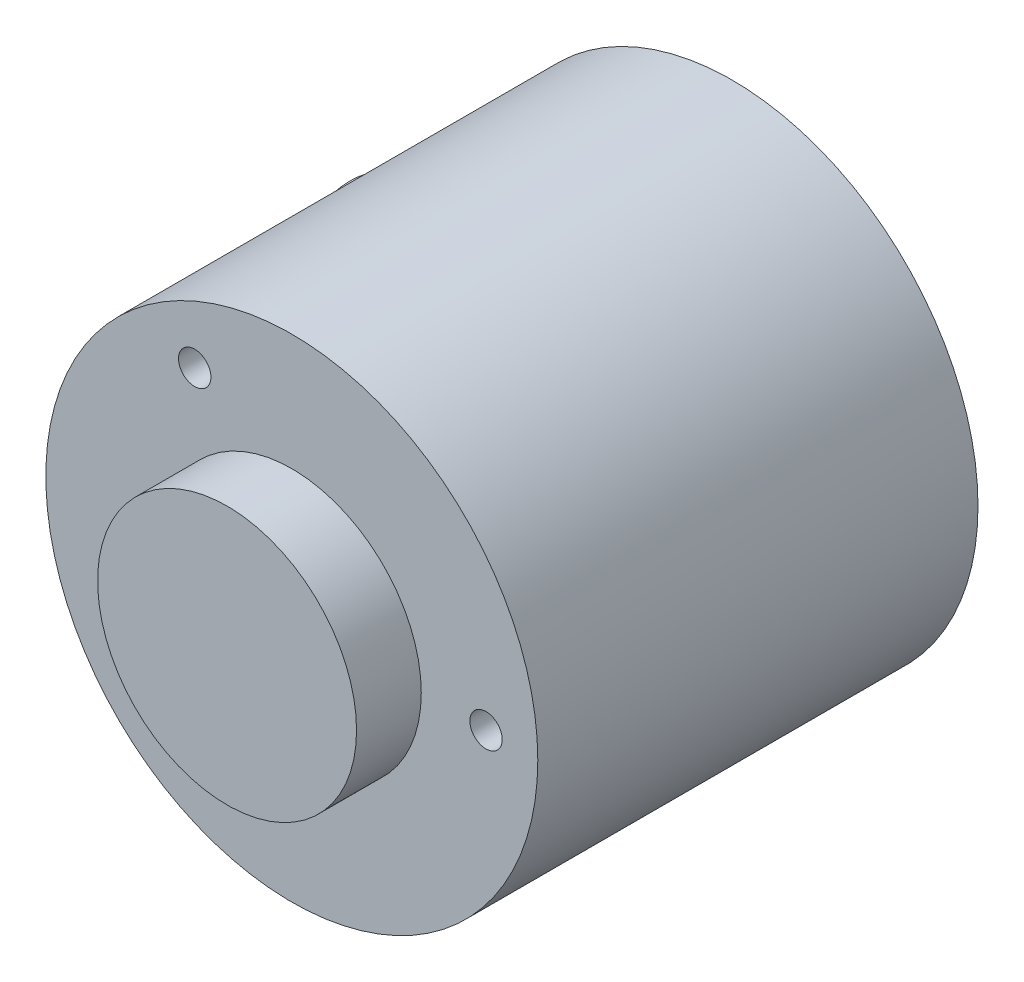
from build123d import *

# Parameters (mm, degrees)
SKETCH_1_R                              = 19
HOUSING_OD38_L34_FROM_DRAWING_DEPTH     = 34
SKETCH_2_R                              = 10
PILOT_OD20_L5_DEPTH                     = 5
SKETCH_3_R                              = 5
SIDE_CABLE_GLAND_ENVELOPE_EST_DEPTH     = 5
SKETCH_4_R                              = 1.25
FRONT_3XM3_PCD30_DEPTH6_REFERENCE_DEPTH = 6


with BuildPart() as part:
    # 草图1 → Housing_OD38_L34_from_drawing (new body)
    with BuildSketch(Plane.XY.offset(-34)):
        Circle(SKETCH_1_R)
    extrude(amount=HOUSING_OD38_L34_FROM_DRAWING_DEPTH)

    # 草图2 → Pilot_OD20_L5 (add)
    with BuildSketch(Plane.XY):
        Circle(SKETCH_2_R)
    extrude(amount=PILOT_OD20_L5_DEPTH)

    # 草图3 → Side_cable_gland_ENVELOPE_EST (add)
    with BuildSketch(Plane(origin=(-22, 0, 0), x_dir=(0, 0, -1), z_dir=(1, 0, 0))):
        with Locations(Location((26.5, 0, 0), (0, 0, 180))):
            Circle(SKETCH_3_R)
    extrude(amount=SIDE_CABLE_GLAND_ENVELOPE_EST_DEPTH)

    # 草图4 → Front_3xM3_PCD30_depth6_reference (cut)
    with BuildSketch(Plane.XY):
        with Locations((15, 0)):
            Circle(SKETCH_4_R)
        with Locations((-7.5, 12.990381057)):
            Circle(SKETCH_4_R)
        with Locations((-7.5, -12.990381057)):
            Circle(SKETCH_4_R)
    extrude(amount=-FRONT_3XM3_PCD30_DEPTH6_REFERENCE_DEPTH, mode=Mode.SUBTRACT)


solid = part.part
